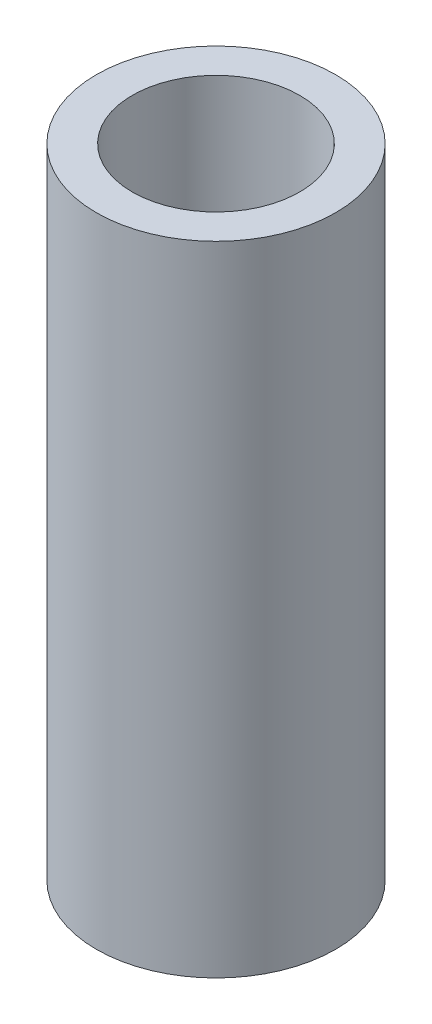
from build123d import *

# Parameters (mm, degrees)
SKETCH1_R           = 3
SKETCH1_R_2         = 2.1
BOSS_EXTRUDE1_DEPTH = 16


with BuildPart() as part:
    # Sketch1 → Boss-Extrude1 (new body)
    with BuildSketch(Plane(origin=(0, 0, 0), x_dir=(1, 0, 0), z_dir=(0, 1, 0))):
        with Locations(Location((0, 0, 0), (0, 0, 270))):
            Circle(SKETCH1_R)
        with Locations(Location((0, 0, 0), (0, 0, 270))):
            Circle(SKETCH1_R_2, mode=Mode.SUBTRACT)
    extrude(amount=BOSS_EXTRUDE1_DEPTH)


solid = part.part
